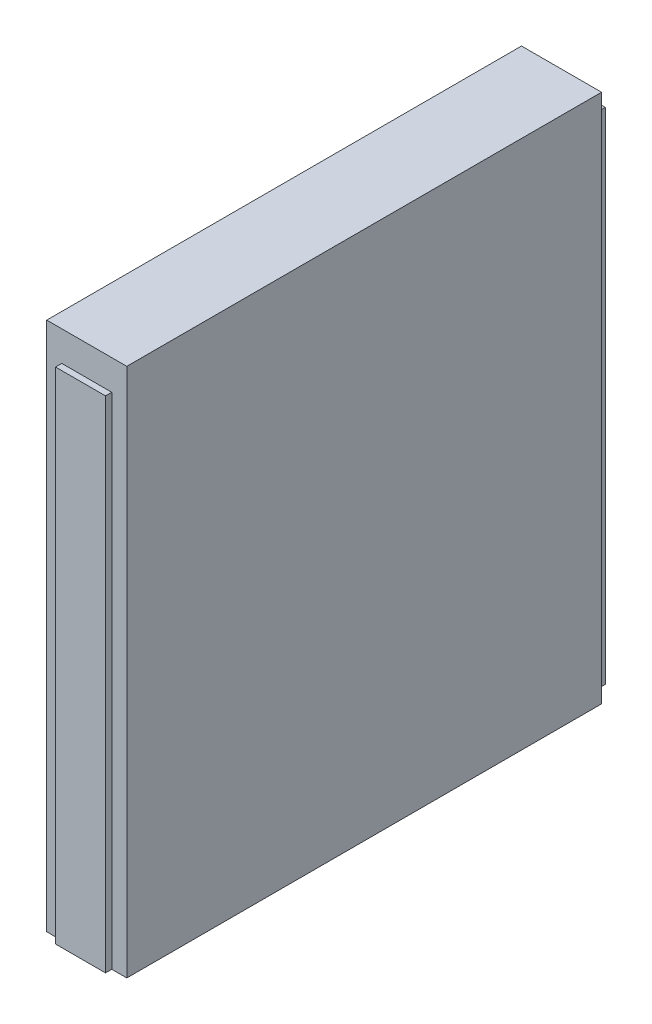
from build123d import *

# Parameters (mm, degrees)
SCHIZZO1_W                   = 40
SCHIZZO1_H                   = 400
ESTRUSIONE_ESTRUSIONE1_DEPTH = 400
SCHIZZO4_W                   = 64.066675396
SCHIZZO4_H                   = 380
ESTRUSIONE_ESTRUSIONE3_DEPTH = 424


with BuildPart() as part:
    # Schizzo1 → Estrusione-Estrusione1 (new body)
    with BuildSketch(Plane.XY):
        Rectangle(SCHIZZO1_W, SCHIZZO1_H)
    extrude(amount=ESTRUSIONE_ESTRUSIONE1_DEPTH)


with BuildPart() as body_2:
    # Schizzo4 → Estrusione-Estrusione3 (new body)
    with BuildSketch(Plane(origin=(0, -200, 0), x_dir=(-1, 0, 0), z_dir=(0, -1, 0))):
        with Locations((0, -205)):
            Rectangle(SCHIZZO4_W, SCHIZZO4_H)
    extrude(amount=-ESTRUSIONE_ESTRUSIONE3_DEPTH)


solid = Compound([part.part, body_2.part])
